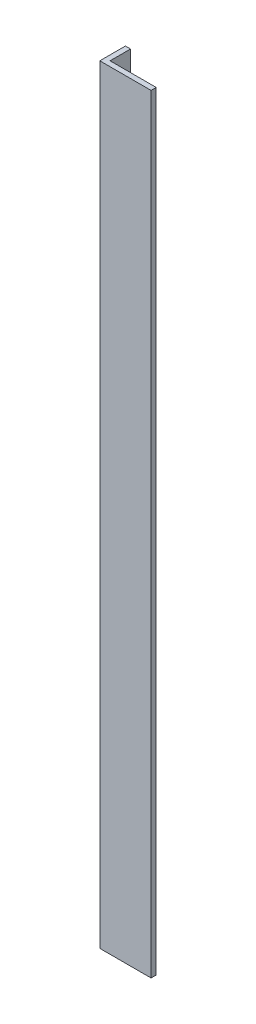
from build123d import *

# Parameters (mm, degrees)
BOSS_EXTRUDE1_DEPTH = 300


with BuildPart() as part:
    # Sketch1 → Boss-Extrude1 (new body)
    with BuildSketch(Plane(origin=(0, 0, 0), x_dir=(1, 0, 0), z_dir=(0, 1, 0))):
        Polygon((0, 0), (0, 10), (2, 10), (2, 2), (20, 2), (20, 0), align=None)
    extrude(amount=BOSS_EXTRUDE1_DEPTH)


solid = part.part
